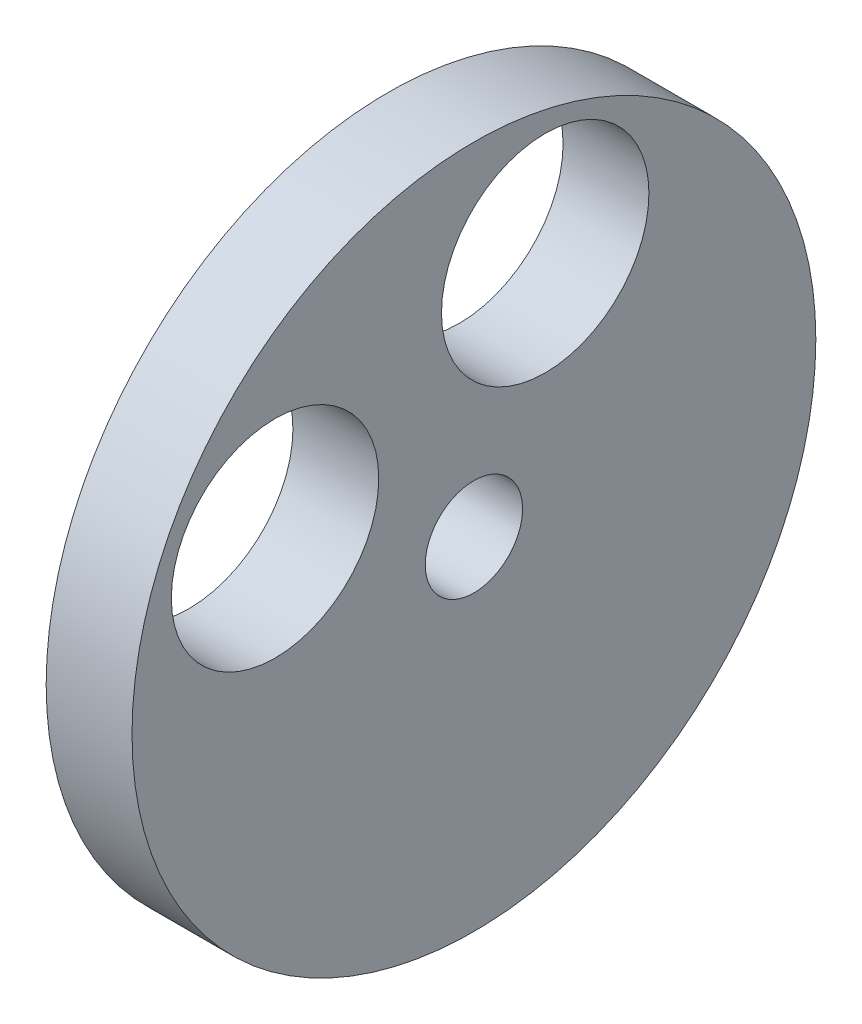
from build123d import *

# Parameters (mm, degrees)
AXIAL_PROFILE_MM_W     = 6
AXIAL_PROFILE_MM_H     = 20.5
AXIAL_HOLES_DEPTH      = 93.40357136
AXIAL_HOLES_DEPTH_BACK = 93.40357136
SKETCH2_R              = 7.25


with BuildPart() as part:
    # Axial profile (mm) → Full revolution (revolve)
    with BuildSketch(Plane.XY, mode=Mode.PRIVATE) as full_revolution_sk:
        with Locations((83, 13.65)):
            Rectangle(AXIAL_PROFILE_MM_W, AXIAL_PROFILE_MM_H)
    revolve(full_revolution_sk.sketch.rotate(Axis((-110, 0, 0), (1, 0, 0)), 90), axis=Axis((-110, 0, 0), (1, 0, 0)))

    # Sketch2 → Axial holes (cut, two sides: drawn at the far end of the back side and taken through both)
    with BuildSketch(Plane(origin=(0, 0, 0), x_dir=(0, 0, -1), z_dir=(1, 0, 0)).offset(-AXIAL_HOLES_DEPTH_BACK)):
        with Locations((4.983070287, 14.677159484)):
            Circle(SKETCH2_R)
        with Locations((-13.90188179, 6.854756209)):
            Circle(SKETCH2_R)
    extrude(amount=AXIAL_HOLES_DEPTH + AXIAL_HOLES_DEPTH_BACK, mode=Mode.SUBTRACT)


solid = part.part
